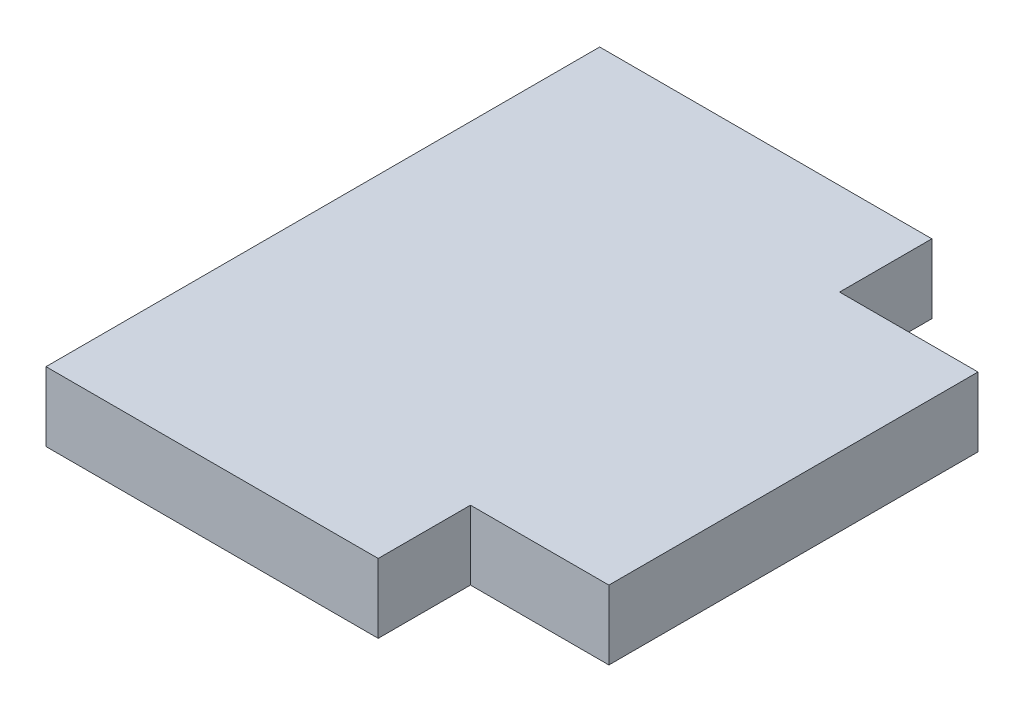
from build123d import *

# Parameters (mm, degrees)
SKETCH_1_W          = 10.2
SKETCH_1_H          = 12
EXTRUDE_1_DEPTH     = 1.5
SKETCH_2_W          = 3
SKETCH_2_H          = 2
CUT_EXTRUDE_1_DEPTH = 16.820556248


with BuildPart() as part:
    # Эскиз1 → Бобышка-Вытянуть1 (new body)
    with BuildSketch(Plane(origin=(0, 0, 0), x_dir=(1, 0, 0), z_dir=(0, 1, 0))):
        with Locations((5.1, 6)):
            Rectangle(SKETCH_1_W, SKETCH_1_H)
    extrude(amount=EXTRUDE_1_DEPTH)

    # Эскиз2 → Вырез-Вытянуть1 (cut, through all)
    with BuildSketch(Plane(origin=(0, 1.5, 0), x_dir=(1, 0, 0), z_dir=(0, 1, 0))):
        with Locations((8.7, 11)):
            Rectangle(SKETCH_2_W, SKETCH_2_H)
        with Locations((8.7, 1)):
            Rectangle(SKETCH_2_W, SKETCH_2_H)
    extrude(amount=-CUT_EXTRUDE_1_DEPTH, mode=Mode.SUBTRACT)


solid = part.part
